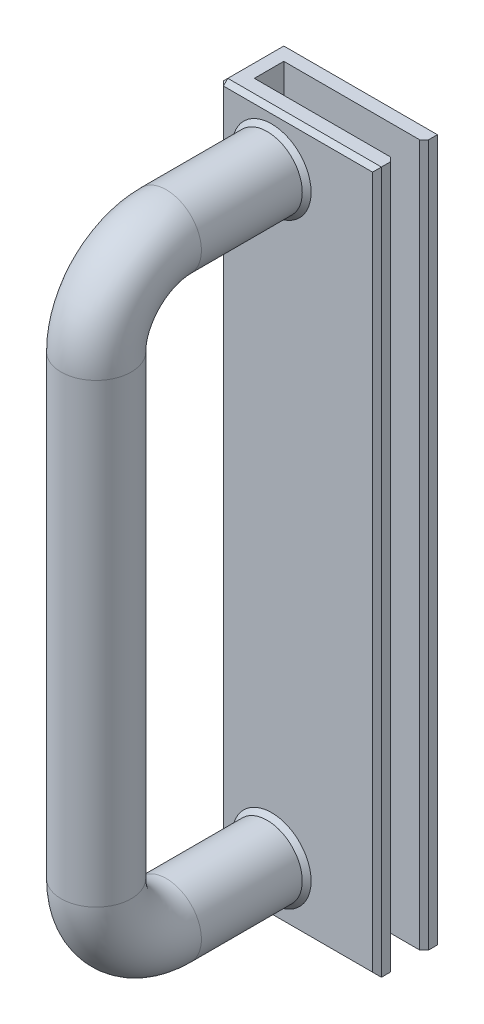
from build123d import *

# Parameters (mm, degrees)
BOSS_EXTRUDE1_DEPTH = 127
SKETCH2_R           = 6.35
CHAMFER1_SIZE       = 0.8


with BuildPart() as part:
    # Sketch1 → Boss-Extrude1 (new body)
    with BuildSketch(Plane(origin=(0, 0, 0), x_dir=(1, 0, 0), z_dir=(0, 1, 0))):
        Polygon((-12.7, 2.667), (12.7, 2.667), (12.7, -2.667), (-12.7, -2.667), (-12.7, -5.867), (15.9, -5.867), (15.9, 5.867), (-12.7, 5.867), align=None)
    extrude(amount=BOSS_EXTRUDE1_DEPTH)

    # Sweep1: sweep along a curve in space
    with BuildLine() as sweep1_path:
        Line((6.375, 9.525, 5.867), (6.375, 9.525, 24.917))
        ThreePointArc((6.375, 9.525, 24.917), (6.375, 13.244743879, 33.897256121), (6.375, 22.225, 37.617))
        Line((6.375, 22.225, 37.617), (6.375, 104.775, 37.617))
        ThreePointArc((6.375, 104.775, 37.617), (6.375, 113.755256121, 33.897256121), (6.375, 117.475, 24.917))
        Line((6.375, 117.475, 24.917), (6.375, 117.475, 5.867))
    # Sketch2 → Sweep1 (sweep)
    with BuildSketch(Plane.XY.offset(5.867)):
        with Locations((6.375, 9.525)):
            Circle(SKETCH2_R)
    sweep(path=sweep1_path.line)

    # Chamfer1
    chamfer1_edges = [part.edges().sort_by_distance(p)[0] for p in [
        (-12.7, 63.5, -5.867),
        (15.9, 63.5, -5.867),
        (15.9, 63.5, 5.867),
        (-12.7, 63.5, 5.867),
        (-12.7, 63.5, 2.667),
        (-12.7, 63.5, -2.667),
        (1.6, 127, 5.867),
        (0.025, 9.525, 5.867),
        (0.025, 117.475, 5.867),
        (15.9, 127, 0),
        (1.6, 127, -5.867),
        (1.6, 0, -5.867),
        (15.9, 0, 0),
        (1.6, 0, 5.867),
    ]]
    chamfer(chamfer1_edges, length=CHAMFER1_SIZE)


with BuildPart() as body_2:
    # Mirror3: mirrored copy
    add(part.part.mirror(Plane(origin=(0, 0, 0), x_dir=(0, 0, 1), z_dir=(1, 0, 0))))


solid = body_2.part
